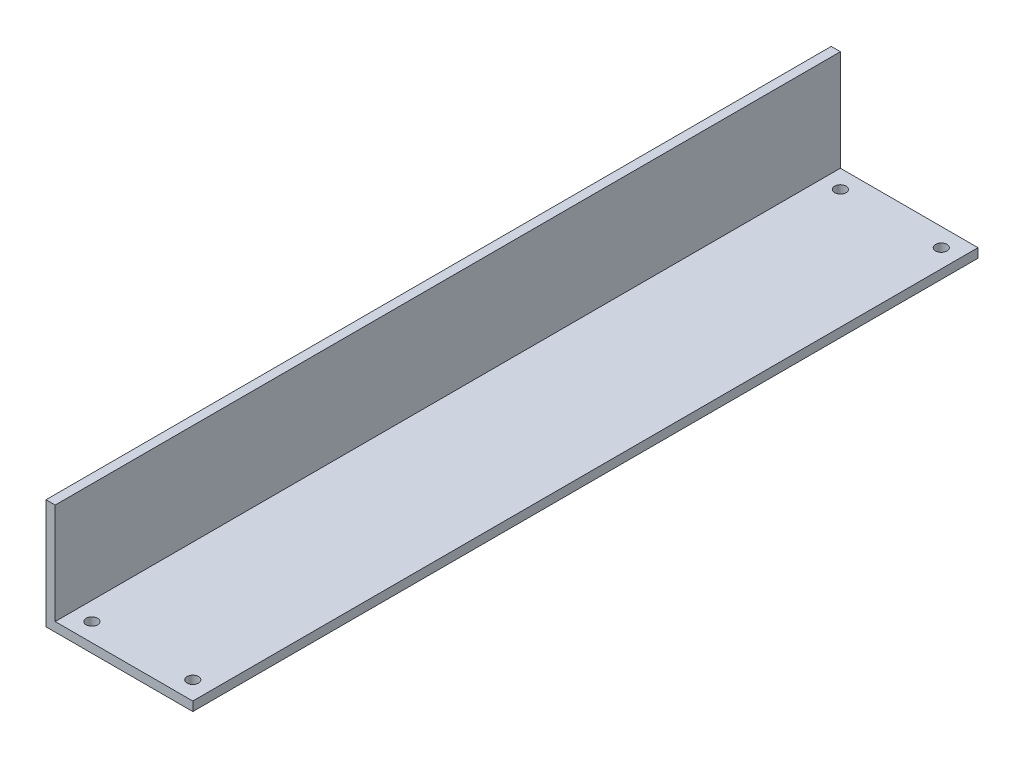
from build123d import *

# Parameters (mm, degrees)
BOSS_EXTRUDE1_DEPTH = 543.5
SKETCH4_R           = 3.96875
CUT_EXTRUDE1_DEPTH  = 559.140887232


with BuildPart() as part:
    # Sketch1 → Boss-Extrude1 (new body)
    with BuildSketch(Plane.XY):
        Polygon((0, 76.2), (0, 0), (101.6, 0), (101.6, 6.35), (6.35, 6.35), (6.35, 76.2), align=None)
    extrude(amount=BOSS_EXTRUDE1_DEPTH)

    # Sketch4 → Cut-Extrude1 (cut, through all)
    with BuildSketch(Plane.XZ):
        with Locations(Location((88.9, 530.8, 0), (0, 0, 270))):
            Circle(SKETCH4_R)
        with Locations(Location((19.05, 530.8, 0), (0, 0, 270))):
            Circle(SKETCH4_R)
        with Locations(Location((19.05, 12.7, 0), (0, 0, 270))):
            Circle(SKETCH4_R)
        with Locations(Location((88.9, 12.7, 0), (0, 0, 270))):
            Circle(SKETCH4_R)
    extrude(amount=-CUT_EXTRUDE1_DEPTH, mode=Mode.SUBTRACT)


solid = part.part
